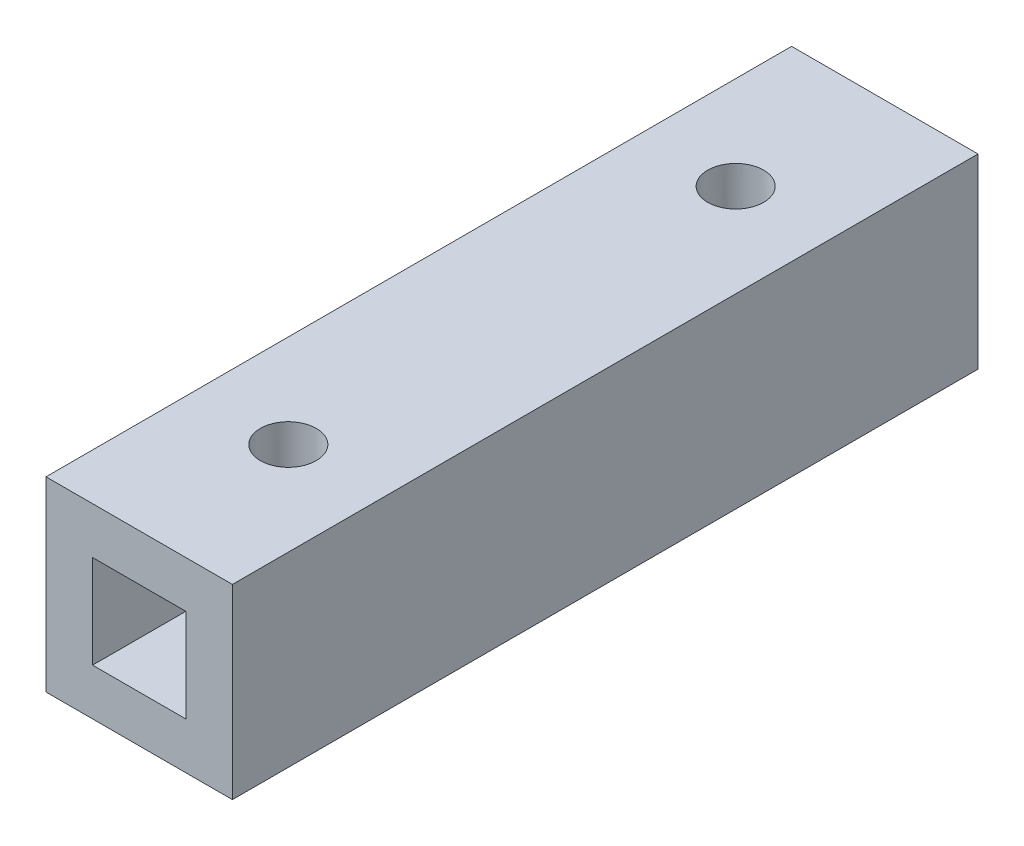
from build123d import *

# Parameters (mm, degrees)
SKETCH_1_W               = 10
SKETCH_1_H               = 10
EXTRUDE_1_DEPTH          = 40
CUT_EXTRUDE_1_DEPTH      = 42.533119315
CUT_EXTRUDE_1_DEPTH_BACK = 42.533119315
SKETCH_2_R               = 1.5
CUT_EXTRUDE_2_DEPTH      = 42.533119315
CUT_EXTRUDE_2_DEPTH_BACK = 42.533119315
SKETCH_3_R               = 1.5
CUT_EXTRUDE_3_DEPTH      = 41.620192023
CUT_EXTRUDE_3_DEPTH_BACK = 41.620192023
SKETCH_4_W               = 5
SKETCH_4_H               = 5


with BuildPart() as part:
    # 草图1 → 凸台-拉伸1 (new body)
    with BuildSketch(Plane.XY):
        Rectangle(SKETCH_1_W, SKETCH_1_H)
    extrude(amount=EXTRUDE_1_DEPTH)

    # 草图2 → 切除-拉伸1 (cut, two sides: drawn at the far end of the back side and taken through both)
    with BuildSketch(Plane(origin=(0, 5, 0), x_dir=(1, 0, 0), z_dir=(0, 1, 0)).offset(-CUT_EXTRUDE_1_DEPTH_BACK)):
        with Locations(Location((0, -8, 0), (0, 0, 270))):
            Circle(SKETCH_2_R)
    extrude(amount=CUT_EXTRUDE_1_DEPTH + CUT_EXTRUDE_1_DEPTH_BACK, mode=Mode.SUBTRACT)

    # 草图3 → 切除-拉伸2 (cut, two sides: drawn at the far end of the back side and taken through both)
    with BuildSketch(Plane(origin=(0, 5, 0), x_dir=(1, 0, 0), z_dir=(0, 1, 0)).offset(-CUT_EXTRUDE_2_DEPTH_BACK)):
        with Locations(Location((0, -32, 0), (0, 0, 270))):
            Circle(SKETCH_3_R)
    extrude(amount=CUT_EXTRUDE_2_DEPTH + CUT_EXTRUDE_2_DEPTH_BACK, mode=Mode.SUBTRACT)

    # 草图4 → 切除-拉伸3 (cut, two sides: drawn at the far end of the back side and taken through both)
    with BuildSketch(Plane.XY.offset(40).offset(-CUT_EXTRUDE_3_DEPTH_BACK)):
        Rectangle(SKETCH_4_W, SKETCH_4_H)
    extrude(amount=CUT_EXTRUDE_3_DEPTH + CUT_EXTRUDE_3_DEPTH_BACK, mode=Mode.SUBTRACT)


solid = part.part
